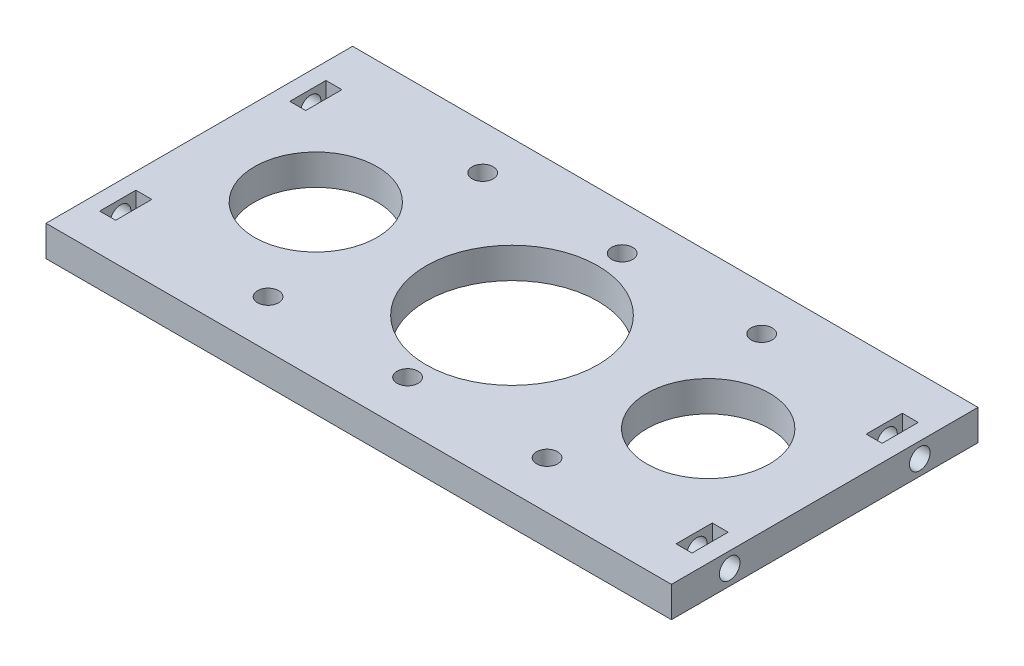
from build123d import *

# Parameters (mm, degrees)
AGUJEROS_W          = 101.999998093
AGUJEROS_H          = 49.999999814
AGUJEROS_R          = 10.000041491
AGUJEROS_R_2        = 14.000010245
AGUJEROS_R_3        = 10.000041173
AGUJEROS_W_2        = 2.599999308
AGUJEROS_H_2        = 5.899999291
AGUJEROS_W_3        = 2.599999309
BOSS_EXTRUDE1_DEPTH = 5
BASE_R              = 1.72
CUT_EXTRUDE1_DEPTH  = 58.330053722
SKETCH4_R           = 1.68
CUT_EXTRUDE2_DEPTH  = 20
CUT_EXTRUDE3_START  = -20
AGUJEROSLATERALES_R = 1.68
CUT_EXTRUDE3_DEPTH  = 20


with BuildPart() as part:
    # Agujeros → Boss-Extrude1 (new body)
    with BuildSketch(Plane(origin=(0, 0, 0), x_dir=(1, 0, 0), z_dir=(0, 1, 0))):
        with Locations((-0.234376955, -0.234376955)):
            Rectangle(AGUJEROS_W, AGUJEROS_H)
        with Locations(Location((31.765623825, -0.234375367, 0), (0, 0, 270))):
            Circle(AGUJEROS_R, mode=Mode.SUBTRACT)
        with Locations(Location((-0.234386768, -0.23435079, 0), (0, 0, 270))):
            Circle(AGUJEROS_R_2, mode=Mode.SUBTRACT)
        with Locations(Location((-32.23437504, -0.234378061, 0), (0, 0, 270))):
            Circle(AGUJEROS_R_3, mode=Mode.SUBTRACT)
        with Locations((46.725622994, -16.184378266)):
            Rectangle(AGUJEROS_W_2, AGUJEROS_H_2, mode=Mode.SUBTRACT)
        with Locations((46.725622994, 14.815623091)):
            Rectangle(AGUJEROS_W_2, AGUJEROS_H_2, mode=Mode.SUBTRACT)
        with Locations((-47.274377513, -16.184378266)):
            Rectangle(AGUJEROS_W_3, AGUJEROS_H_2, mode=Mode.SUBTRACT)
        with Locations((-47.274377513, 14.815623091)):
            Rectangle(AGUJEROS_W_3, AGUJEROS_H_2, mode=Mode.SUBTRACT)
    extrude(amount=BOSS_EXTRUDE1_DEPTH)

    # Base → Cut-Extrude1 (cut, through all)
    with BuildSketch(Plane(origin=(0, 5, 0), x_dir=(1, 0, 0), z_dir=(0, 1, 0))):
        with Locations(Location((0, 17.5, 0), (0, 0, 270))):
            Circle(BASE_R)
        with Locations(Location((-22.75, 17.5, 0), (0, 0, 270))):
            Circle(BASE_R)
        with Locations(Location((22.75, 17.5, 0), (0, 0, 270))):
            Circle(BASE_R)
        with Locations(Location((0, -17.5, 0), (0, 0, 270))):
            Circle(BASE_R)
        with Locations(Location((22.75, -17.5, 0), (0, 0, 270))):
            Circle(BASE_R)
        with Locations(Location((-22.75, -17.5, 0), (0, 0, 270))):
            Circle(BASE_R)
    extrude(amount=-CUT_EXTRUDE1_DEPTH, mode=Mode.SUBTRACT)

    # Sketch4 → Cut-Extrude2 (cut)
    with BuildSketch(Plane.ZY.offset(51.234376001)):
        with Locations((-15.265622952, 2.5)):
            Circle(SKETCH4_R)
        with Locations((15.734376862, 2.5)):
            Circle(SKETCH4_R)
    extrude(amount=-CUT_EXTRUDE2_DEPTH, mode=Mode.SUBTRACT)

    # AgujerosLaterales → Cut-Extrude3 (cut)
    with BuildSketch(Plane(origin=(50.765622092, 0, 0), x_dir=(0, 0, -1), z_dir=(1, 0, 0)).offset(CUT_EXTRUDE3_START)):
        with Locations(Location((-15.734376862, 2.5, 0), (0, 0, 180))):
            Circle(AGUJEROSLATERALES_R)
        with Locations(Location((15.265622952, 2.5, 0), (0, 0, 180))):
            Circle(AGUJEROSLATERALES_R)
    extrude(amount=CUT_EXTRUDE3_DEPTH, mode=Mode.SUBTRACT)


solid = part.part
